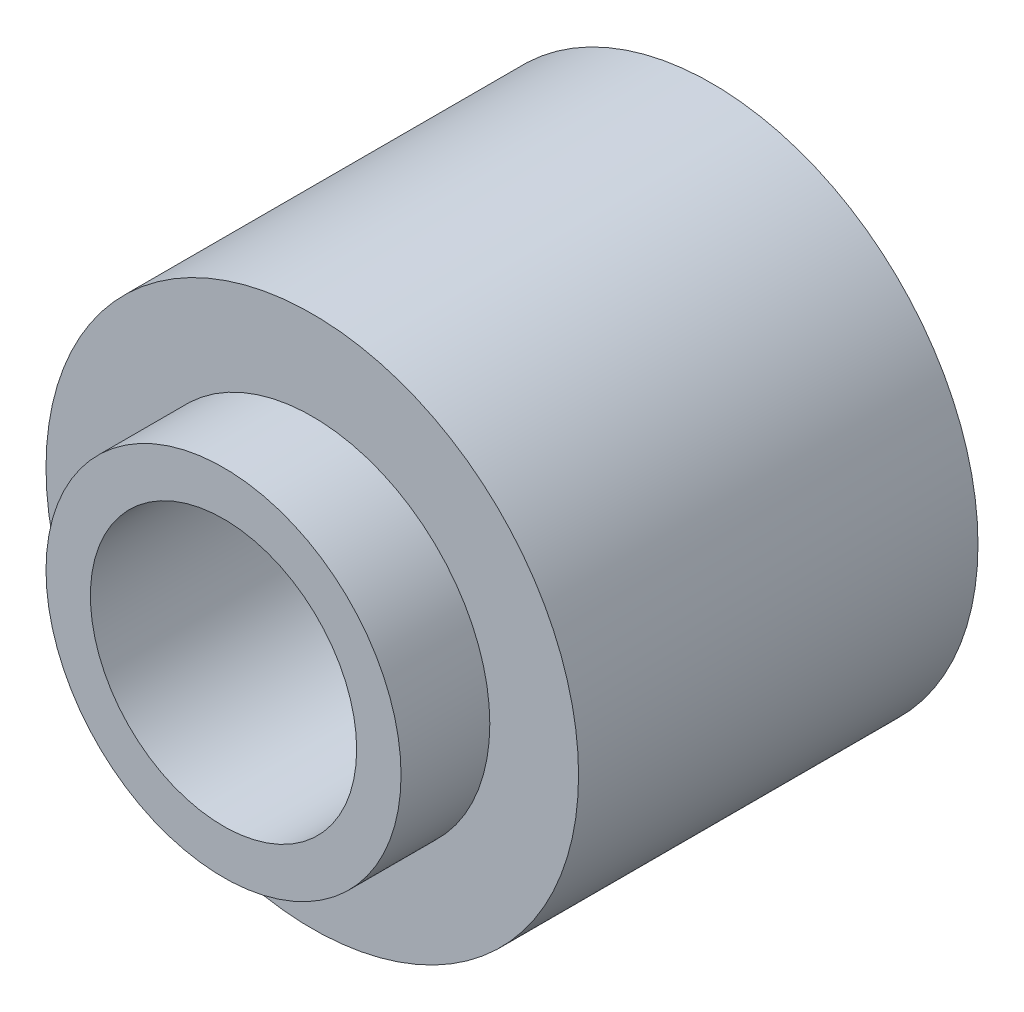
from build123d import *

# Parameters (mm, degrees)
SKETCH_1_R      = 6
SKETCH_1_R_2    = 3
EXTRUDE_1_DEPTH = 9
SKETCH_2_R      = 4
SKETCH_2_R_2    = 3
EXTRUDE_2_DEPTH = 2


with BuildPart() as part:
    # 草图1 → 凸台-拉伸1 (new body)
    with BuildSketch(Plane.XY):
        Circle(SKETCH_1_R)
        Circle(SKETCH_1_R_2, mode=Mode.SUBTRACT)
    extrude(amount=EXTRUDE_1_DEPTH)

    # 草图2 → 凸台-拉伸2 (add)
    with BuildSketch(Plane.XY.offset(9)):
        Circle(SKETCH_2_R)
        Circle(SKETCH_2_R_2, mode=Mode.SUBTRACT)
    extrude(amount=EXTRUDE_2_DEPTH)


solid = part.part
